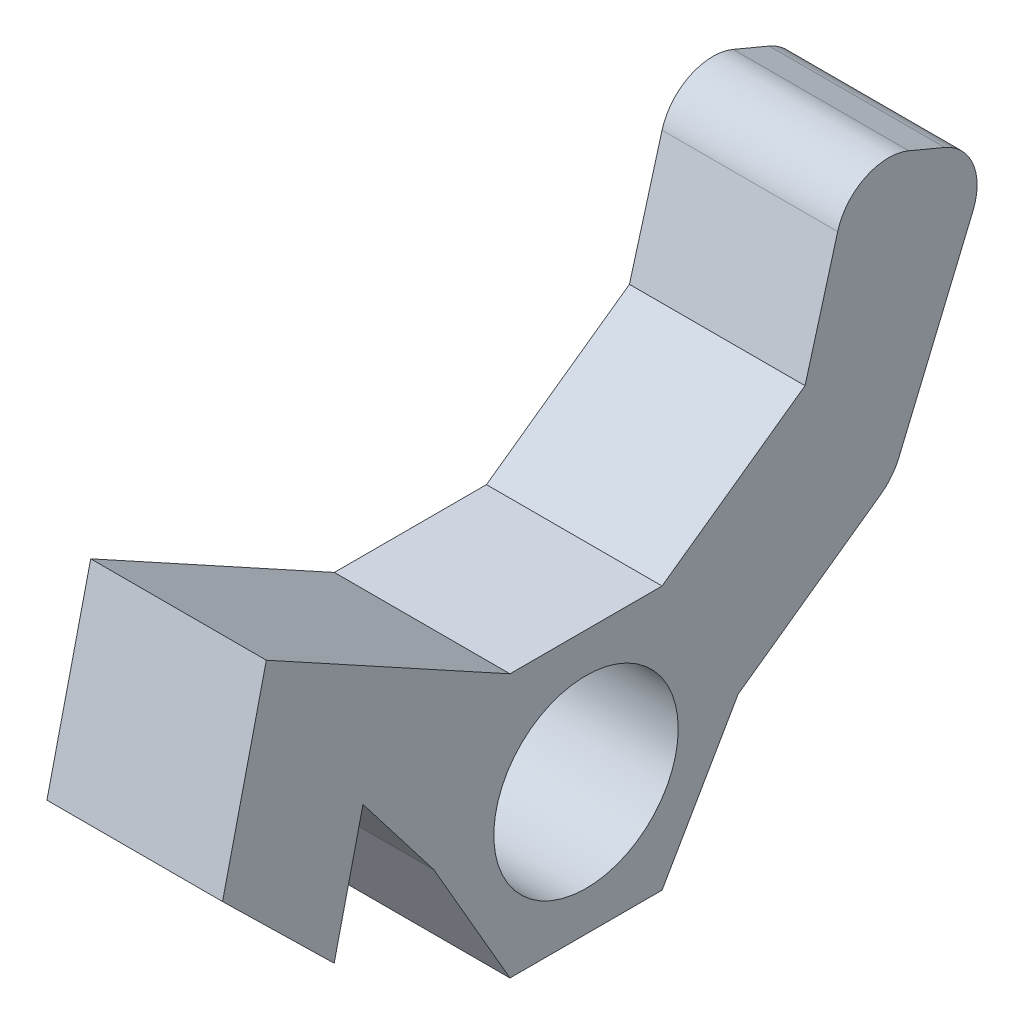
from build123d import *

# Parameters (mm, degrees)
CROQUIS1_R              = 2.1
SALIENTE_EXTRUIR1_DEPTH = 4
SALIENTE_EXTRUIR2_DEPTH = 4
SALIENTE_EXTRUIR3_DEPTH = 4
SALIENTE_EXTRUIR4_DEPTH = 4
REDONDEO1_R             = 1.2


with BuildPart() as part:
    # Croquis1 → Saliente-Extruir1 (new body)
    with BuildSketch(Plane(origin=(0, 0, 0), x_dir=(0, 0, -1), z_dir=(1, 0, 0))):
        Polygon((3.464101615, 0), (1.732050808, 3), (-1.732050808, 3), (-3.464101615, 0), (-1.732050808, -3), (1.732050808, -3), align=None)
        Circle(CROQUIS1_R, mode=Mode.SUBTRACT)
    extrude(amount=SALIENTE_EXTRUIR1_DEPTH)

    # Croquis2 → Saliente-Extruir2 (add, through all)
    with BuildSketch(Plane(origin=(4, 0, 0), x_dir=(0, 0, -1), z_dir=(1, 0, 0))):
        Polygon((6.990847349, 2.515265858), (3.464101615, 0), (1.732050808, 3), (4.988660177, 5.322605307), align=None)
    extrude(amount=-SALIENTE_EXTRUIR2_DEPTH)

    # Croquis12 → Saliente-Extruir3 (add, through all)
    with BuildSketch(Plane(origin=(4, 0, 0), x_dir=(0, 0, -1), z_dir=(1, 0, 0))):
        Polygon((-7.281299997, 6.043148081), (-1.732050808, 3), (-3.464101615, 0), (-5.080008932, 2.097632781), (-5.736212746, -0.706387852), (-8.278793458, 1.780764673), align=None)
    extrude(amount=-SALIENTE_EXTRUIR3_DEPTH)

    # Croquis13 → Saliente-Extruir4 (add, through all)
    with BuildSketch(Plane(origin=(4, 0, 0), x_dir=(0, 0, -1), z_dir=(1, 0, 0))):
        Polygon((6.990847349, 2.515265858), (9.278705783, 7.966164247), (6.097551134, 9.301362773), (4.988660177, 5.322605307), align=None)
    extrude(amount=-SALIENTE_EXTRUIR4_DEPTH)

    # Redondeo1
    redondeo1_edges = [part.edges().sort_by_distance(p)[0] for p in [
        (2, 2.515265858, -6.990847349),
        (2, 9.301362773, -6.097551134),
        (2, 7.966164247, -9.278705783),
    ]]
    fillet(redondeo1_edges, radius=REDONDEO1_R)


solid = part.part
